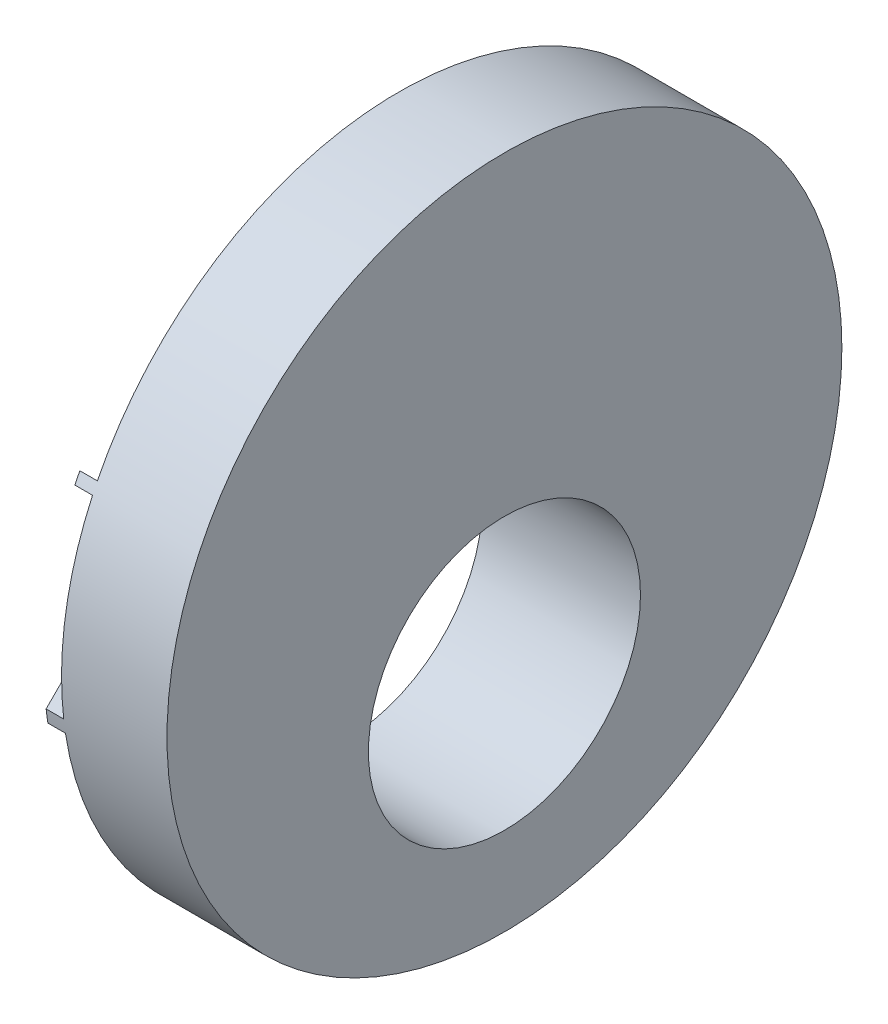
from build123d import *
from build123d.topology import SkipClean

# Parameters (mm, degrees)
SKETCH1_R           = 47.99995
SKETCH1_R_2         = 19.35
SKETCH1_W           = 70
SKETCH1_H           = 6.35
BOSS_EXTRUDE1_DEPTH = 7.5
SKETCH1_3_W         = 70
SKETCH1_3_H         = 6.35
BOSS_EXTRUDE2_DEPTH = 5
SKETCH2_W           = 70
SKETCH2_H           = 6.35
BOSS_EXTRUDE3_DEPTH = 10
SKETCH3_R           = 19.35
BOSS_EXTRUDE4_DEPTH = 15
SKETCH4_R           = 47.99995
SKETCH4_R_2         = 40.49995
BOSS_EXTRUDE5_DEPTH = 7.5


with BuildPart() as part:
    # Sketch1 → Boss-Extrude1 (new body)
    with BuildSketch(Plane(origin=(0, 0, 0), x_dir=(0, 0, -1), z_dir=(1, 0, 0))):
        Circle(SKETCH1_R)
        with Locations((0, -16.134793457)):
            Circle(SKETCH1_R_2, mode=Mode.SUBTRACT)
        with Locations((0, 9.390206543)):
            Rectangle(SKETCH1_W, SKETCH1_H, mode=Mode.SUBTRACT)
    extrude(amount=-BOSS_EXTRUDE1_DEPTH)

    # Sketch1<3> → Boss-Extrude2 (add)
    with BuildSketch(Plane(origin=(0, 0, 0), x_dir=(0, 0, -1), z_dir=(1, 0, 0))):
        with Locations((0, 9.390206543)):
            Rectangle(SKETCH1_3_W, SKETCH1_3_H)
    extrude(amount=-BOSS_EXTRUDE2_DEPTH)

    # Sketch2 → Boss-Extrude3 (add)
    with SkipClean():  # the faces are left unmerged after this step: merging them gives an invalid solid
        with BuildSketch(Plane.ZY.offset(7.5)):
            with BuildLine():
                Line((-47.443323347, -7.288776975), (-36.939339828, 3.215206543))
                Line((-36.939339828, 3.215206543), (36.939339828, 3.215206543))
                Line((36.939339828, 3.215206543), (47.443323347, -7.288776975))
                ThreePointArc((47.443323347, -7.288776975), (47.577493547, -6.354314108), (47.693260005, -5.41739329))
                Line((47.693260005, -5.41739329), (38, 4.275866715))
                Line((38, 4.275866715), (38, 14.504546372))
                Line((38, 14.504546372), (43.590913129, 20.095459501))
                ThreePointArc((43.590913129, 20.095459501), (43.252246865, 20.814378231), (42.901724899, 21.527591614))
                Line((42.901724899, 21.527591614), (36.939339828, 15.565206543))
                Line((36.939339828, 15.565206543), (-36.939339828, 15.565206543))
                Line((-36.939339828, 15.565206543), (-42.901724899, 21.527591614))
                ThreePointArc((-42.901724899, 21.527591614), (-43.252246865, 20.814378231), (-43.590913129, 20.095459501))
                Line((-43.590913129, 20.095459501), (-38, 14.504546372))
                Line((-38, 14.504546372), (-38, 4.275866715))
                Line((-38, 4.275866715), (-47.693260005, -5.41739329))
                ThreePointArc((-47.693260005, -5.41739329), (-47.577493547, -6.354314108), (-47.443323347, -7.288776975))
            make_face()
            with Locations((0, 9.390206543)):
                Rectangle(SKETCH2_W, SKETCH2_H, mode=Mode.SUBTRACT)
        extrude(amount=BOSS_EXTRUDE3_DEPTH)

    # Sketch3 → Boss-Extrude4 (add)
    with SkipClean():  # the faces are left unmerged after this step: merging them gives an invalid solid
        with BuildSketch(Plane.ZY.offset(7.5)):
            with BuildLine():
                Line((14.879516121, 6.215206543), (-14.879516121, 6.215206543))
                ThreePointArc((-14.879516121, 6.215206543), (0, -42.984793457), (14.879516121, 6.215206543))
            make_face()
            with Locations(Location((0, -16.134793457, 0), (0, 0, 180))):
                Circle(SKETCH3_R, mode=Mode.SUBTRACT)
        extrude(amount=BOSS_EXTRUDE4_DEPTH)

    # Sketch4 → Boss-Extrude5 (add)
    with SkipClean():  # the faces are left unmerged after this step: merging them gives an invalid solid
        with BuildSketch(Plane.ZY.offset(7.5)):
            with Locations(Location((0, 0, 0), (0, 0, 180))):
                Circle(SKETCH4_R)
            Circle(SKETCH4_R_2, mode=Mode.SUBTRACT)
        extrude(amount=BOSS_EXTRUDE5_DEPTH)


solid = part.part
